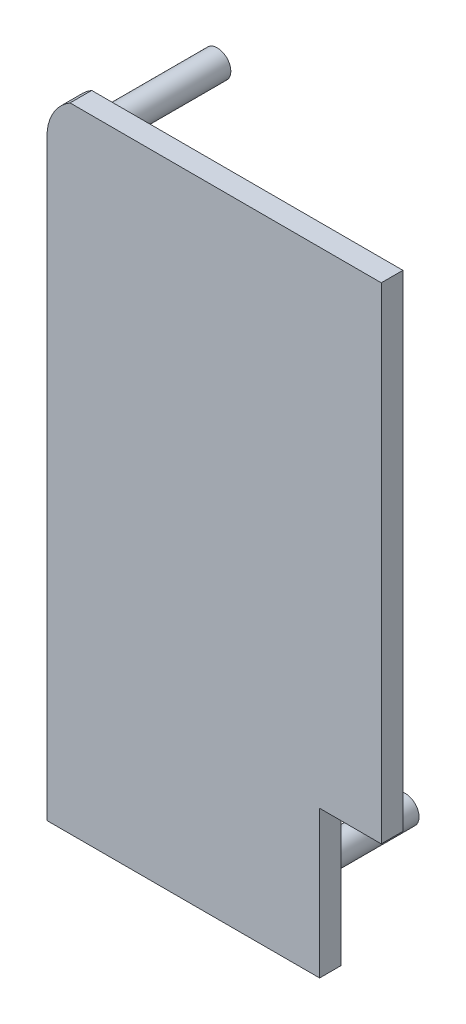
from build123d import *

# Parameters (mm, degrees)
BOSS_EXTRUDE1_DEPTH = 1.6
SKETCH3_R           = 1
BOSS_EXTRUDE2_DEPTH = 9


with BuildPart() as part:
    # Sketch1 → Boss-Extrude1 (new body)
    with BuildSketch(Plane.XY):
        with BuildLine():
            Line((-41.383181355, 43.426165336), (-41.383181355, 7.477968892))
            Line((-41.383181355, 7.477968892), (-45.94349159, 7.477968892))
            Line((-45.94349159, 7.477968892), (-45.94349159, -3.396104602))
            Line((-45.94349159, -3.396104602), (-66.113144039, -3.396104602))
            Line((-66.113144039, -3.396104602), (-66.113144039, 40.440533192))
            ThreePointArc((-66.113144039, 40.440533192), (-65.656687939, 42.166215415), (-64.406709132, 43.4405326))
            Line((-64.406709132, 43.4405326), (-41.383181355, 43.426165336))
        make_face()
    extrude(amount=BOSS_EXTRUDE1_DEPTH)

    # Sketch3 → Boss-Extrude2 (add)
    with BuildSketch(Plane(origin=(0, 0, 0), x_dir=(-1, 0, 0), z_dir=(0, 0, -1))):
        with Locations((50.189000543, 0)):
            Circle(SKETCH3_R)
        with Locations((60.928928446, 0)):
            Circle(SKETCH3_R)
        with Locations((64.113441952, 40.81521395)):
            Circle(SKETCH3_R)
    extrude(amount=BOSS_EXTRUDE2_DEPTH)


solid = part.part
